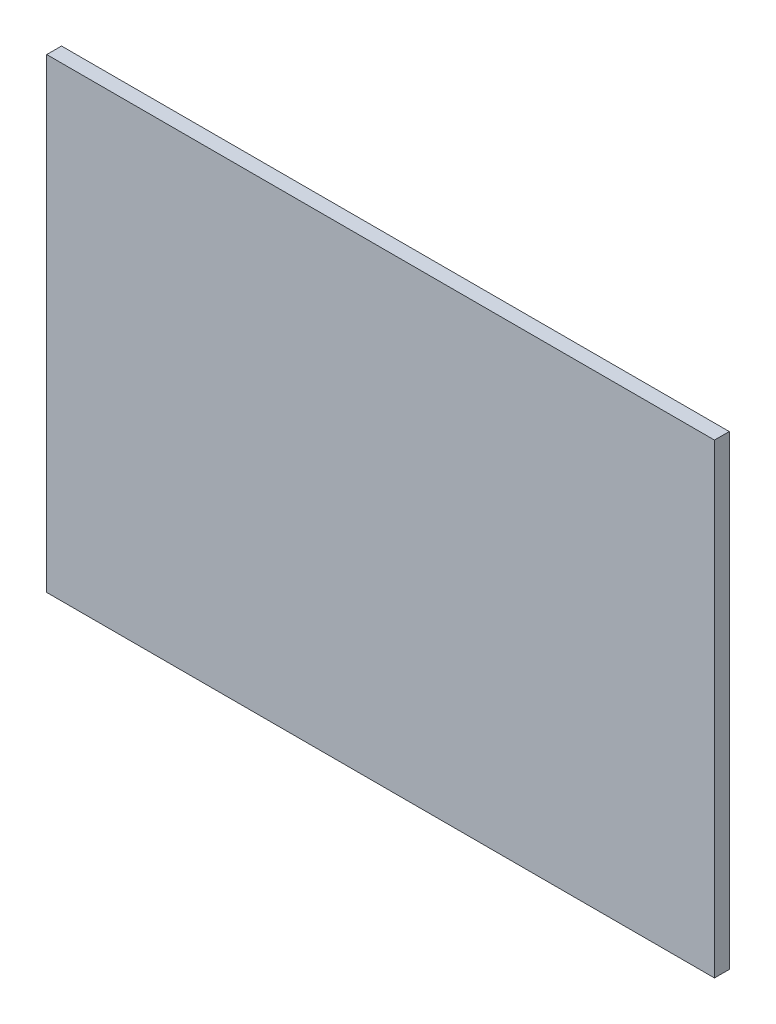
from build123d import *

# Parameters (mm, degrees)
SKETCH1_W           = 860
SKETCH1_H           = 600
BOSS_EXTRUDE1_DEPTH = 19.05


with BuildPart() as part:
    # Sketch1 → Boss-Extrude1 (new body)
    with BuildSketch(Plane.XY):
        Rectangle(SKETCH1_W, SKETCH1_H)
    extrude(amount=BOSS_EXTRUDE1_DEPTH)


solid = part.part
